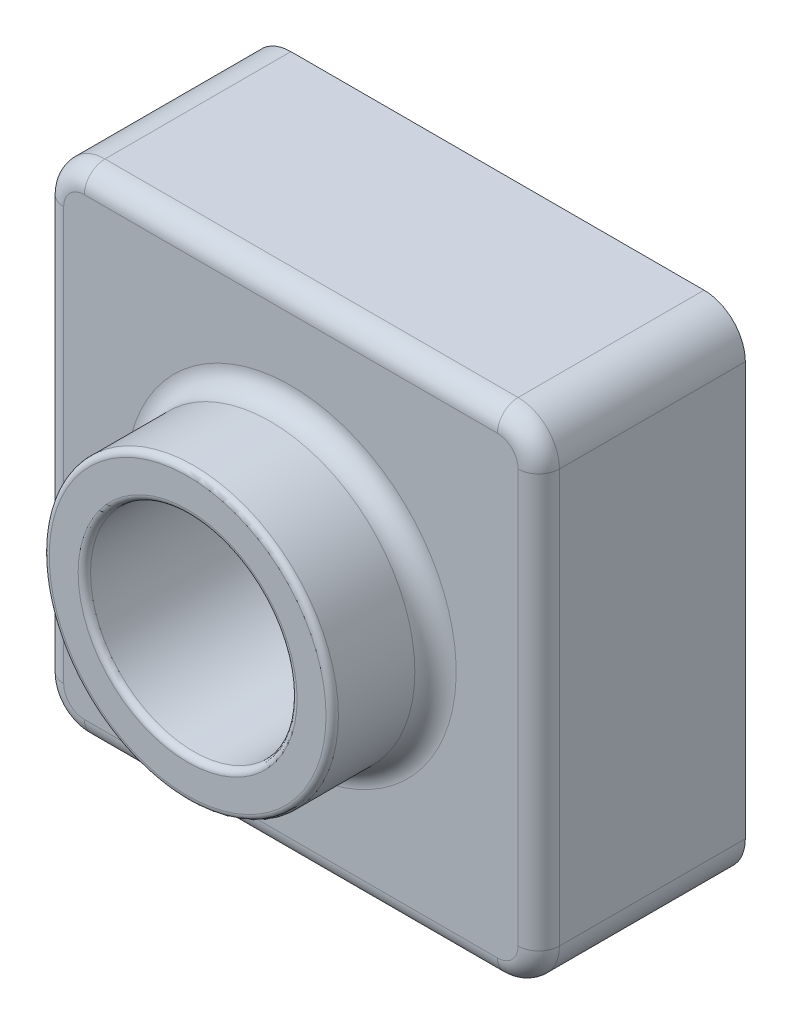
from build123d import *

# Parameters (mm, degrees)
SKETCH1_W           = 120
SKETCH1_H           = 120
BOSS_EXTRUDE2_DEPTH = 50
SKETCH2_R           = 35
BOSS_EXTRUDE3_DEPTH = 25
SKETCH3_R           = 25
CUT_EXTRUDE1_DEPTH  = 186.539753153
FILLET1_R           = 10
FILLET2_R           = 1.5
FILLET3_R           = 5
SHELL1_T            = -2


with BuildPart() as part:
    # Sketch1 → Boss-Extrude2 (new body)
    with BuildSketch(Plane.XY):
        with Locations((60, 60)):
            Rectangle(SKETCH1_W, SKETCH1_H)
    extrude(amount=BOSS_EXTRUDE2_DEPTH)

    # Sketch2 → Boss-Extrude3 (add)
    with BuildSketch(Plane.XY.offset(50)):
        with Locations(Location((60, 60, 0), (0, 0, 180))):
            Circle(SKETCH2_R)
    extrude(amount=BOSS_EXTRUDE3_DEPTH)

    # Sketch3 → Cut-Extrude1 (cut, through all)
    with BuildSketch(Plane.XY.offset(75)):
        with Locations((60, 60)):
            Circle(SKETCH3_R)
    extrude(amount=-CUT_EXTRUDE1_DEPTH, mode=Mode.SUBTRACT)

    # Fillet1
    fillet1_edges = [part.edges().sort_by_distance(p)[0] for p in [
        (0, 120, 25),
        (120, 120, 25),
        (120, 0, 25),
        (0, 0, 25),
    ]]
    fillet(fillet1_edges, radius=FILLET1_R)

    # Fillet2
    fillet2_edges = [part.edges().sort_by_distance(p)[0] for p in [
        (95, 60, 75),
        (35, 60, 75),
    ]]
    fillet(fillet2_edges, radius=FILLET2_R)

    # Fillet3
    fillet3_edges = [part.edges().sort_by_distance(p)[0] for p in [
        (95, 60, 50),
        (60, 0, 50),
        (0, 60, 50),
        (120, 60, 50),
        (60, 120, 50),
        (2.928932188, 117.071067812, 50),
        (117.071067812, 117.071067812, 50),
        (117.071067812, 2.928932188, 50),
        (2.928932188, 2.928932188, 50),
    ]]
    fillet(fillet3_edges, radius=FILLET3_R)

    # Shell1
    shell1_openings = [part.faces().sort_by_distance(p)[0] for p in [
        (60, 1.697056275, 0),
    ]]
    offset(amount=SHELL1_T, openings=shell1_openings, kind=Kind.INTERSECTION)


solid = part.part
